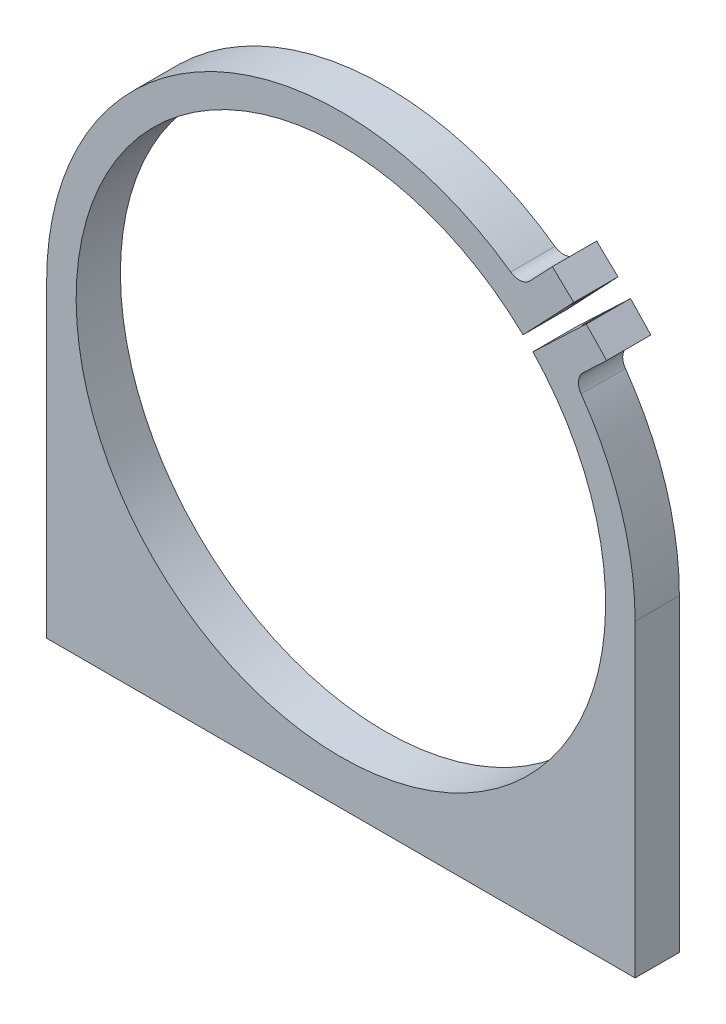
from build123d import *

# Parameters (mm, degrees)
BOSS_EXTRUDE1_DEPTH        = 9.525
F_10_32_TAPPED_HOLE2_D     = 4.0386
F_10_32_TAPPED_HOLE2_DEPTH = 14.5796
F_6_0_204_DIAMETER_HOLE1_D = 5.1816


with BuildPart() as part:
    # Sketch1 → Boss-Extrude1 (new body)
    with BuildSketch(Plane.XY):
        with BuildLine():
            Line((-63.3222, 0), (-63.3222, -66.4972))
            Line((-63.3222, -66.4972), (63.3222, -66.4972))
            Line((63.3222, -66.4972), (63.3222, 0))
            ThreePointArc((63.3222, 0), (60.350483171, 19.170816203), (51.714258587, 36.542255974))
            ThreePointArc((51.714258587, 36.542255974), (51.142998099, 38.702969527), (52.124965643, 40.710645135))
            Line((52.124965643, 40.710645135), (57.191705625, 45.518801846))
            Line((57.191705625, 45.518801846), (52.820654069, 50.124929102))
            Line((52.820654069, 50.124929102), (41.32617374, 39.217074557))
            ThreePointArc((41.32617374, 39.217074557), (-40.285428959, -40.285428959), (39.217074557, 41.32617374))
            Line((39.217074557, 41.32617374), (50.124929102, 52.820654069))
            Line((50.124929102, 52.820654069), (45.518801846, 57.191705625))
            Line((45.518801846, 57.191705625), (40.710645135, 52.124965643))
            ThreePointArc((40.710645135, 52.124965643), (38.702969527, 51.142998099), (36.542255974, 51.714258587))
            ThreePointArc((36.542255974, 51.714258587), (-29.11842176, 56.230050036), (-63.3222, 0))
        make_face()
    extrude(amount=BOSS_EXTRUDE1_DEPTH)

    # #10-32 Tapped Hole2
    with Locations(Plane(origin=(0, -66.4972, 0), x_dir=(-1, 0, 0), z_dir=(0, -1, 0))):
        with Locations((-41.275, -4.7625), (41.275, -4.7625)):
            Hole(F_10_32_TAPPED_HOLE2_D / 2, depth=F_10_32_TAPPED_HOLE2_DEPTH)

    # #6 (0.204) Diameter Hole1 (through all)
    with Locations(Plane(origin=(54.658335634, 43.114723491, 4.7625), x_dir=(-0.725374371012, -0.688354575694, 0), z_dir=(0.688354575694, -0.725374371012, 0))):
        with Locations((0, 0)):
            Hole(F_6_0_204_DIAMETER_HOLE1_D / 2)


solid = part.part
